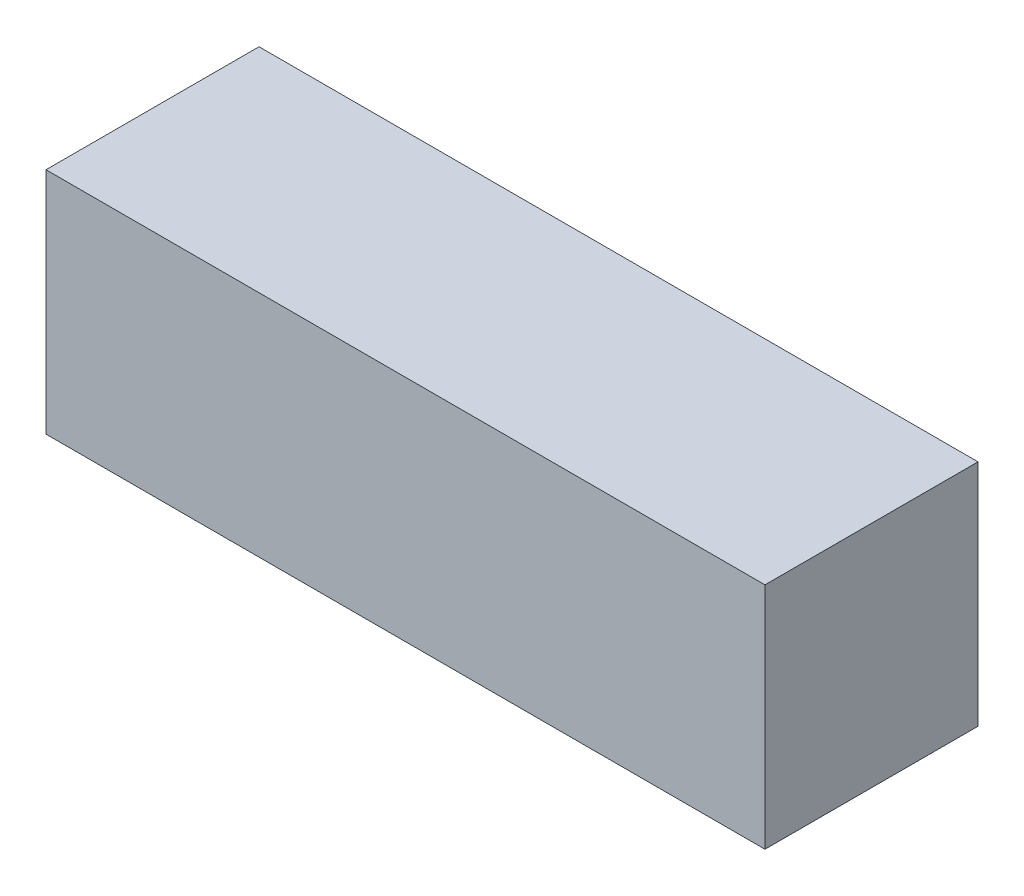
from build123d import *

# Parameters (mm, degrees)
SKETCH1_W           = 135
SKETCH1_H           = 40
BOSS_EXTRUDE1_DEPTH = 43


with BuildPart() as part:
    # Sketch1 → Boss-Extrude1 (new body)
    with BuildSketch(Plane(origin=(0, 0, 0), x_dir=(1, 0, 0), z_dir=(0, 1, 0))):
        Rectangle(SKETCH1_W, SKETCH1_H)
    extrude(amount=BOSS_EXTRUDE1_DEPTH)


solid = part.part
